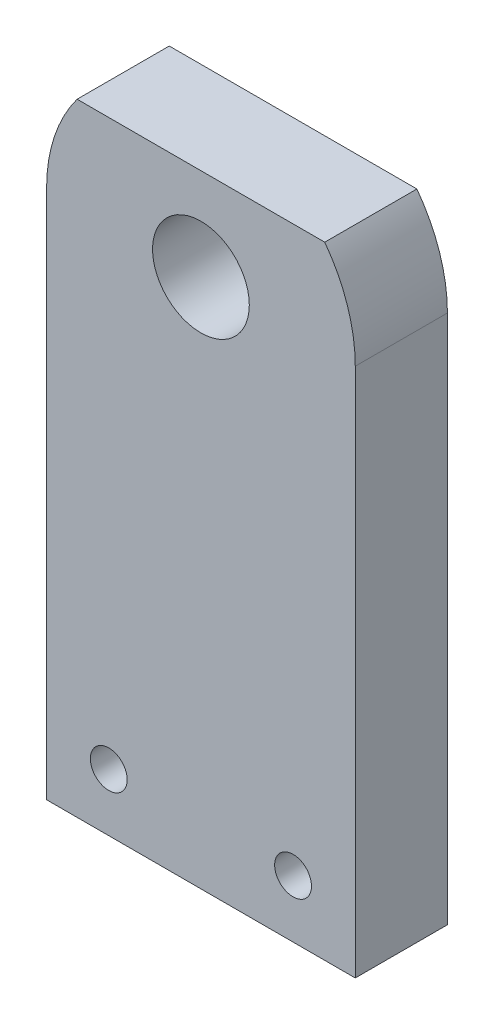
from build123d import *

# Parameters (mm, degrees)
RESSALTO_EXTRUS_O1_DEPTH                = 4
FURO_ROSCADO_DE_M2X0_41_D               = 1.6
FURO_ROSCADO_PARA_CONDU_TE_DE_M4X0_71_D = 4.2


with BuildPart() as part:
    # Esboço1 → Ressalto-extrusão1 (new body)
    with BuildSketch(Plane.XY):
        with BuildLine():
            Line((-6.7, 0), (-6.7, -23))
            Line((-6.7, -23), (6.7, -23))
            Line((6.7, -23), (6.7, 0))
            ThreePointArc((6.7, 0), (6.360114404, 2.10688034), (5.37494186, 4))
            Line((5.37494186, 4), (-5.37494186, 4))
            ThreePointArc((-5.37494186, 4), (-6.360114404, 2.10688034), (-6.7, 0))
        make_face()
    extrude(amount=RESSALTO_EXTRUS_O1_DEPTH)

    # Furo roscado de M2x0.41 (through all)
    with Locations(Plane(origin=(-4, -20.5, 4), x_dir=(1, 0, 0), z_dir=(0, 0, 1))):
        with Locations((0, 0), (8, 0)):
            Hole(FURO_ROSCADO_DE_M2X0_41_D / 2)

    # Furo roscado para conduíte de M4x0.71 (through all)
    with Locations(Plane.XY.offset(4)):
        with Locations((0, 0)):
            Hole(FURO_ROSCADO_PARA_CONDU_TE_DE_M4X0_71_D / 2)


solid = part.part
